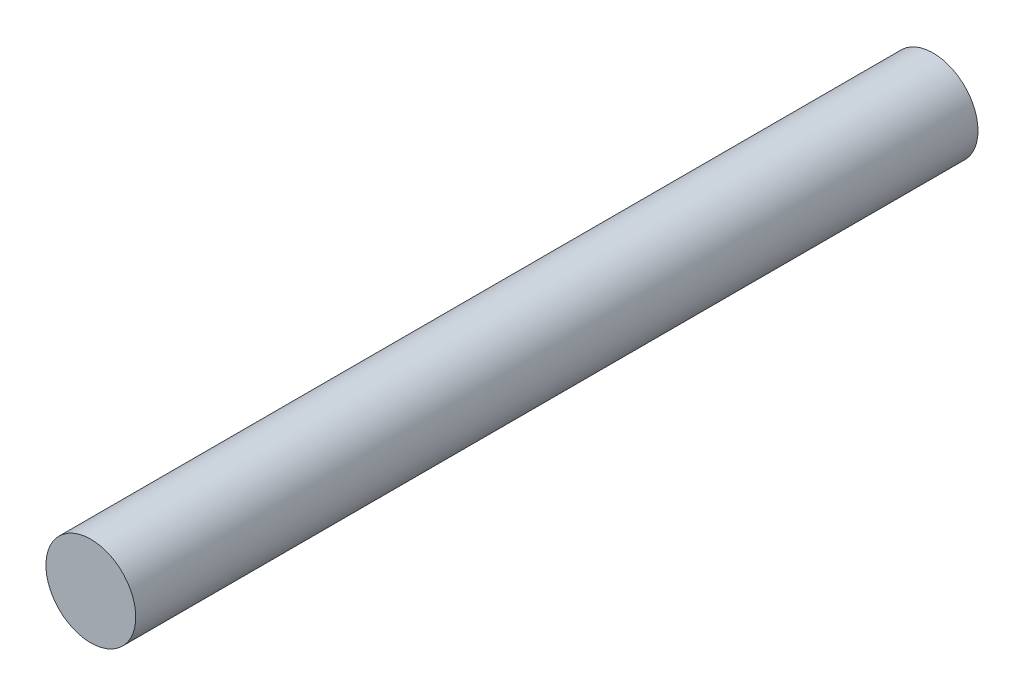
from build123d import *

# Parameters (mm, degrees)
SKETCH1_R           = 0.4
BOSS_EXTRUDE1_DEPTH = 7.5


with BuildPart() as part:
    # Sketch1 → Boss-Extrude1 (new body)
    with BuildSketch(Plane.XY):
        Circle(SKETCH1_R)
    extrude(amount=BOSS_EXTRUDE1_DEPTH)


solid = part.part
